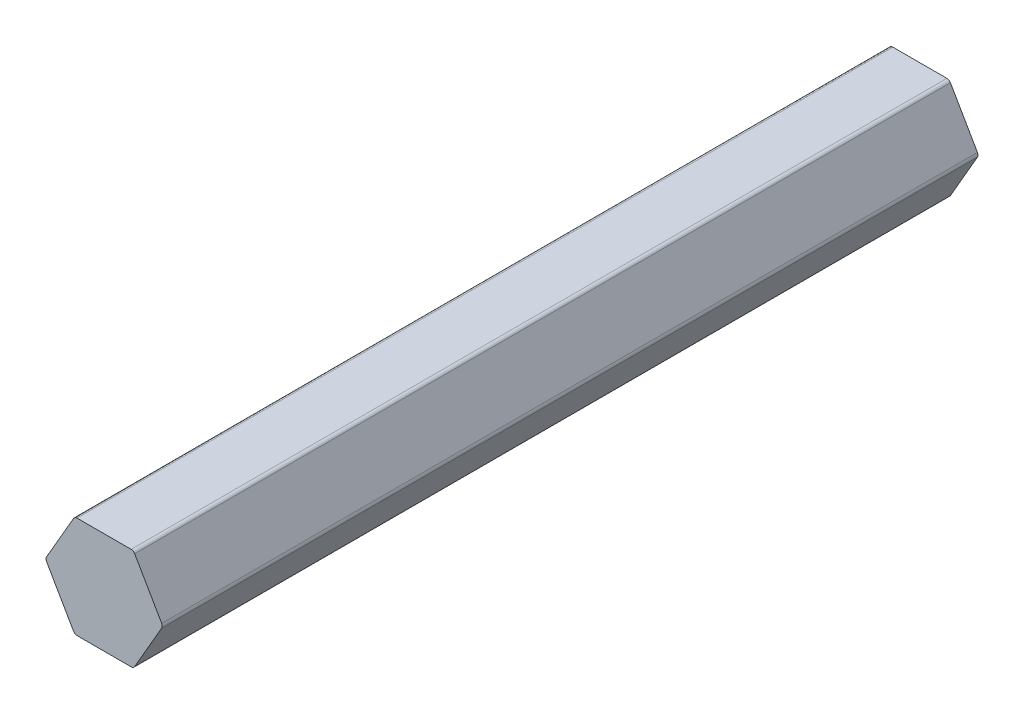
from build123d import *

# Parameters (mm, degrees)
BOSS_EXTRUDE1_DEPTH = 101.6


with BuildPart() as part:
    # Sketch1 → Boss-Extrude1 (new body)
    with BuildSketch(Plane(origin=(0, 0, -228.6), x_dir=(-1, 0, 0), z_dir=(0, 0, -1))):
        with BuildLine():
            Line((3.805488829, -6.0833), (7.171036753, -0.254))
            ThreePointArc((7.171036753, -0.254), (7.239095848, 0), (7.171036753, 0.254))
            Line((7.171036753, 0.254), (3.805488829, 6.0833))
            ThreePointArc((3.805488829, 6.0833), (3.619547924, 6.269240905), (3.365547924, 6.3373))
            Line((3.365547924, 6.3373), (-3.365547924, 6.3373))
            ThreePointArc((-3.365547924, 6.3373), (-3.619547924, 6.269240905), (-3.805488829, 6.0833))
            Line((-3.805488829, 6.0833), (-7.171036753, 0.254))
            ThreePointArc((-7.171036753, 0.254), (-7.239095848, 0), (-7.171036753, -0.254))
            Line((-7.171036753, -0.254), (-3.805488829, -6.0833))
            ThreePointArc((-3.805488829, -6.0833), (-3.619547924, -6.269240905), (-3.365547924, -6.3373))
            Line((-3.365547924, -6.3373), (3.365547924, -6.3373))
            ThreePointArc((3.365547924, -6.3373), (3.619547924, -6.269240905), (3.805488829, -6.0833))
        make_face()
    extrude(amount=-BOSS_EXTRUDE1_DEPTH)


solid = part.part
